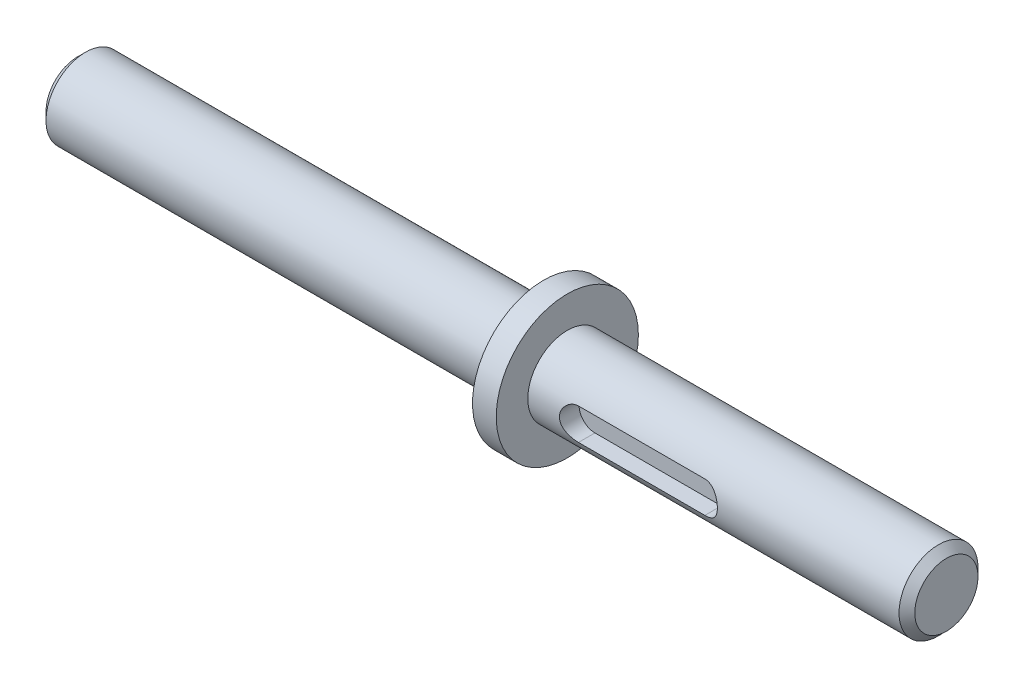
from build123d import *

# Parameters (mm, degrees)
CUT_EXTRUDE1_DEPTH = 2.5
CHAMFER1_SIZE      = 1


with BuildPart() as part:
    # Sketch1 → Revolve1 (revolve)
    with BuildSketch(Plane(origin=(0, 0, 0), x_dir=(1, 0, 0), z_dir=(0, 1, 0)), mode=Mode.PRIVATE) as revolve1_sk:
        Polygon((-59, 0), (-59, -5), (0, -5), (0, -9), (3, -9), (3, -5), (51, -5), (51, 0), align=None)
    revolve(revolve1_sk.sketch.rotate(Axis((0, 0, 0), (-1, 0, 0)), 180), axis=Axis((0, 0, 0), (-1, 0, 0)))

    # Sketch2 → Cut-Extrude1 (cut)
    with BuildSketch(Plane.XY.offset(5)):
        with BuildLine():
            Line((9, 2), (25, 2))
            ThreePointArc((25, 2), (27, 0), (25, -2))
            Line((25, -2), (9, -2))
            ThreePointArc((9, -2), (7, 0), (9, 2))
        make_face()
    extrude(amount=-CUT_EXTRUDE1_DEPTH, mode=Mode.SUBTRACT)

    # Chamfer1
    chamfer1_edges = [part.edges().sort_by_distance(p)[0] for p in [
        (51, 0, 5),
        (-59, 0, 5),
    ]]
    chamfer(chamfer1_edges, length=CHAMFER1_SIZE)


solid = part.part
